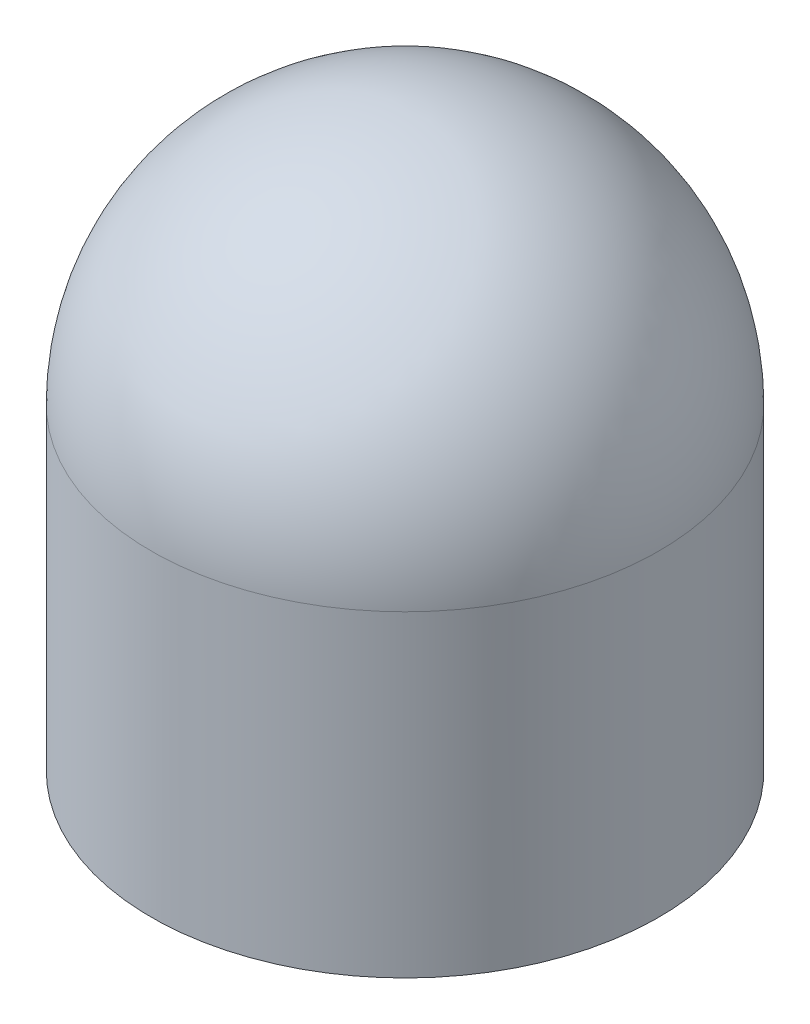
from build123d import *

# Parameters (mm, degrees)
CROQUIS2_R            = 5
CORTAR_EXTRUIR1_DEPTH = 12.5


with BuildPart() as part:
    # Croquis1 → Revolución2 (revolve)
    with BuildSketch(Plane.XY):
        with BuildLine():
            Line((-10, 0), (0, 0))
            Line((0, 0), (0, 22.5))
            ThreePointArc((0, 22.5), (-7.071067812, 19.571067812), (-10, 12.5))
            Line((-10, 12.5), (-10, 0))
        make_face()
    revolve(axis=Axis((0, 0, 0), (0, 1, 0)))

    # Croquis2 → Cortar-Extruir1 (cut)
    with BuildSketch(Plane.XZ):
        with Locations(Location((0, 0, 0), (0, 0, 270))):
            Circle(CROQUIS2_R)
    extrude(amount=-CORTAR_EXTRUIR1_DEPTH, mode=Mode.SUBTRACT)


solid = part.part
